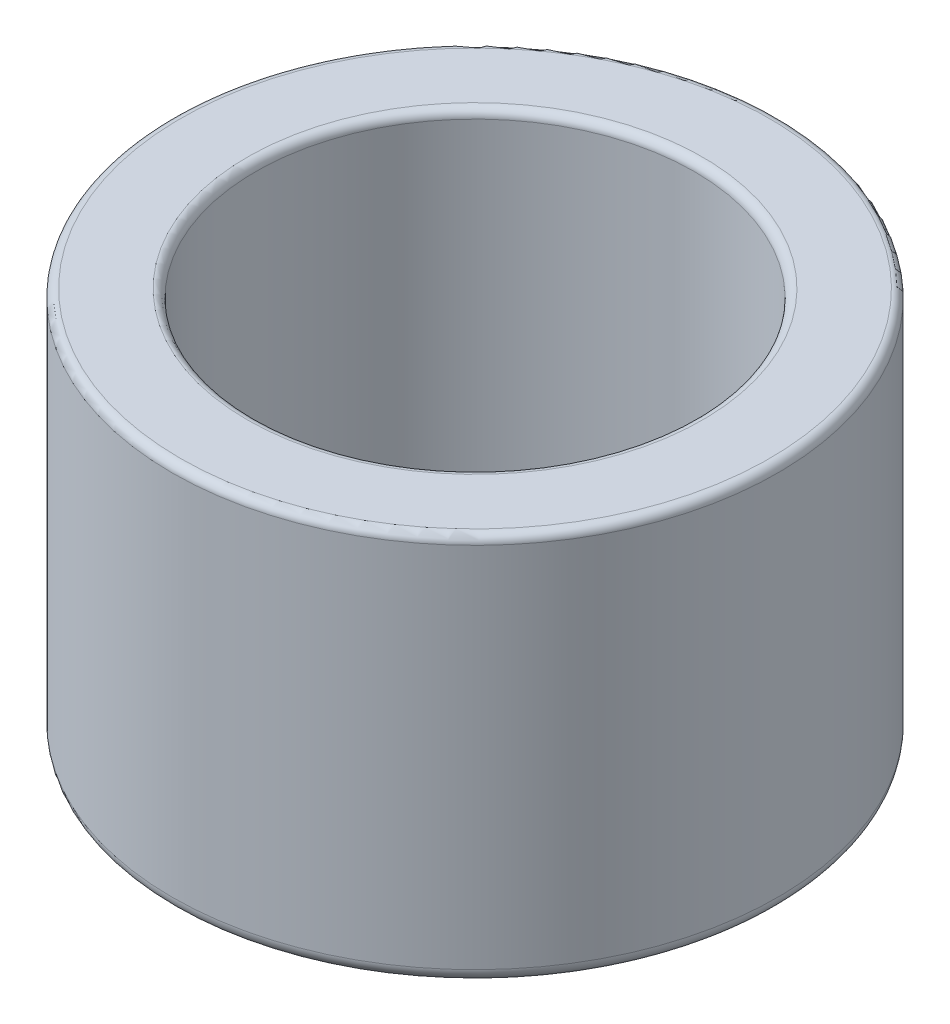
from build123d import *

# Parameters (mm, degrees)
SKETCH1_R           = 10.87817
SKETCH1_R_2         = 7.87817
BOSS_EXTRUDE1_DEPTH = 14
FILLET1_R           = 0.3
FILLET5_R           = 0.3
FILLET6_R           = 0.5
FILLET7_R           = 0.5


with BuildPart() as part:
    # Sketch1 → Boss-Extrude1 (new body)
    with BuildSketch(Plane(origin=(0, 0, 0), x_dir=(1, 0, 0), z_dir=(0, 1, 0))):
        with Locations(Location((0, 0, 0), (0, 0, 270))):
            Circle(SKETCH1_R)
        with Locations(Location((0, 0, 0), (0, 0, 270))):
            Circle(SKETCH1_R_2, mode=Mode.SUBTRACT)
    extrude(amount=BOSS_EXTRUDE1_DEPTH)

    # Fillet1
    fillet1_edges = [part.edges().sort_by_distance(p)[0] for p in [
        (0, 14, -10.87817),
    ]]
    fillet(fillet1_edges, radius=FILLET1_R)

    # Fillet5
    fillet5_edges = [part.edges().sort_by_distance(p)[0] for p in [
        (0, 14, -7.87817),
    ]]
    fillet(fillet5_edges, radius=FILLET5_R)

    # Fillet6
    fillet6_edges = [part.edges().sort_by_distance(p)[0] for p in [
        (0, 0, -10.87817),
    ]]
    fillet(fillet6_edges, radius=FILLET6_R)

    # Fillet7
    fillet7_edges = [part.edges().sort_by_distance(p)[0] for p in [
        (0, 0, -7.87817),
    ]]
    fillet(fillet7_edges, radius=FILLET7_R)


solid = part.part
